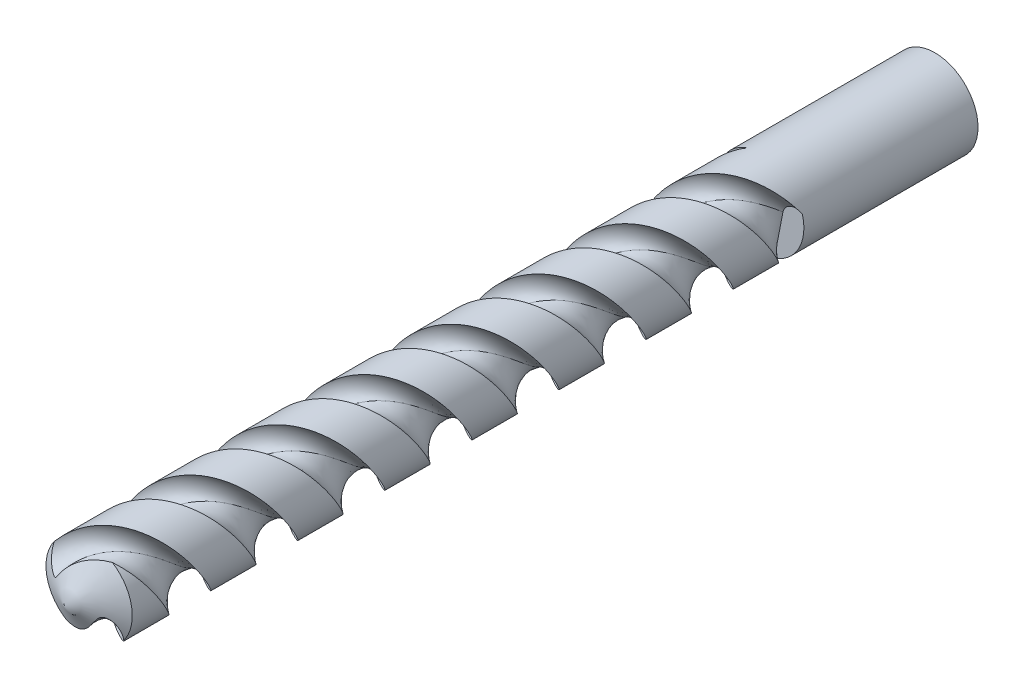
from build123d import *

# Parameters (mm, degrees)
SKETCH1_R              = 4.949999999999999
BOSS_EXTRUDE3_DEPTH    = 100
CUT_SWEEP1_PITCH       = 19.99999999999996
CUT_SWEEP1_HEIGHT      = 80.00000000000004
CUT_SWEEP1_RADIUS      = 4.949999999999999
CUT_SWEEP1_START_ANGLE = -3.8463e-13
CIRPATTERN1_COUNT      = 2


with BuildPart() as part:
    # Sketch1 → Boss-Extrude3 (new body)
    with BuildSketch(Plane.XY):
        with Locations((0, -0.01978001875300572)):
            Circle(SKETCH1_R)
    extrude(amount=BOSS_EXTRUDE3_DEPTH)

    # Cut-Sweep1: sweep along a helix
    with BuildLine() as cut_sweep1_path:
        add(Helix(CUT_SWEEP1_PITCH, CUT_SWEEP1_HEIGHT, CUT_SWEEP1_RADIUS, center=(0, -0.01978001875300572, 100), direction=(0, 0, -1), mode=Mode.PRIVATE).rotate(Axis((0, -0.01978001875300572, 100), (0, 0, -1)), CUT_SWEEP1_START_ANGLE))
    # Sketch8 → Cut-Sweep1 (sweep, cut)
    with BuildSketch(Plane.XY.offset(100)):
        with BuildLine():
            Line((-2.5513455730409906, -0.40888199928261515), (-1.5653022069127382, 4.676210718145238))
            ThreePointArc((-1.5653022069127382, 4.676210718145238), (-3.603805497140352, 3.3736085441411663), (-4.781562500000001, 1.2605168447102113))
            ThreePointArc((-4.781562500000001, 1.2605168447102113), (-4.89887487162264, -1.2206230414522197), (-2.5513455730409906, -0.40888199928261515))
        make_face()
    cut_sweep1 = sweep(path=cut_sweep1_path.line, is_frenet=True, mode=Mode.SUBTRACT)

    # CirPattern1: Cut-Sweep1 ×2 about axis
    cirpattern1_axis = Axis((0, -0.01978001875300572, 0), (0, 0, 1))
    for i in range(1, CIRPATTERN1_COUNT):
        add(cut_sweep1.rotate(cirpattern1_axis, i * 360 / CIRPATTERN1_COUNT), mode=Mode.SUBTRACT)

    # Sketch13 → Cut-Revolve4 (revolve, cut)
    with BuildSketch(Plane(origin=(0, 0, 0), x_dir=(1, 0, 0), z_dir=(0, 1, 0)), mode=Mode.PRIVATE) as cut_revolve4_sk:
        Polygon((-0.00696244957097344, -100), (5.013717410047662, -97.10130913153424), (5.013717410047664, -102.00000000000001), (-0.00696244957097344, -102.00000000000001), align=None)
    revolve(cut_revolve4_sk.sketch.rotate(Axis((-0.00696244957097344, 0, 102.00000000000001), (0, 0, -1)), 180), axis=Axis((-0.00696244957097344, 0, 102.00000000000001), (0, 0, -1)), mode=Mode.SUBTRACT)


solid = part.part
